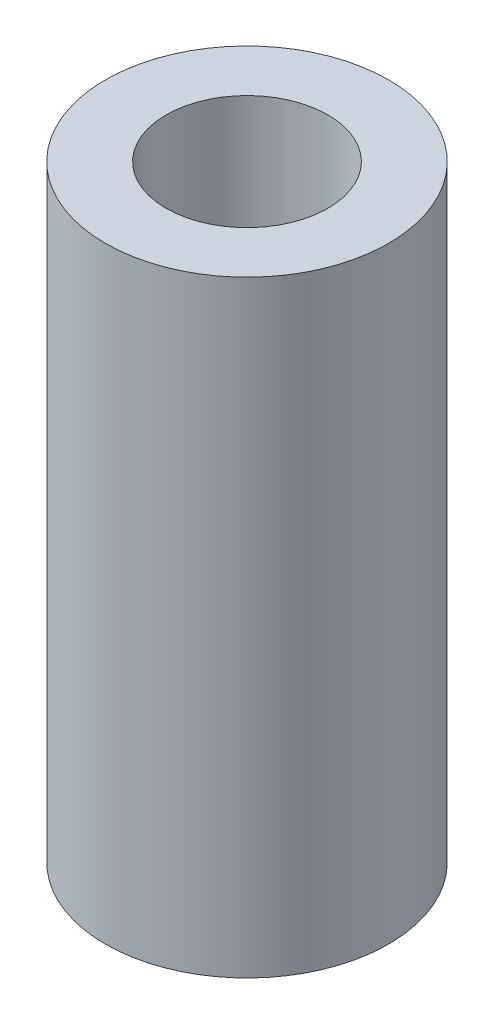
from build123d import *

# Parameters (mm, degrees)
SKETCH1_R           = 3.5
SKETCH1_R_2         = 2
BOSS_EXTRUDE1_DEPTH = 15


with BuildPart() as part:
    # Sketch1 → Boss-Extrude1 (new body)
    with BuildSketch(Plane(origin=(0, 0, 0), x_dir=(1, 0, 0), z_dir=(0, 1, 0))):
        with Locations(Location((0, 0, 0), (0, 0, 270))):
            Circle(SKETCH1_R)
        with Locations(Location((0, 0, 0), (0, 0, 270))):
            Circle(SKETCH1_R_2, mode=Mode.SUBTRACT)
    extrude(amount=BOSS_EXTRUDE1_DEPTH)


solid = part.part
